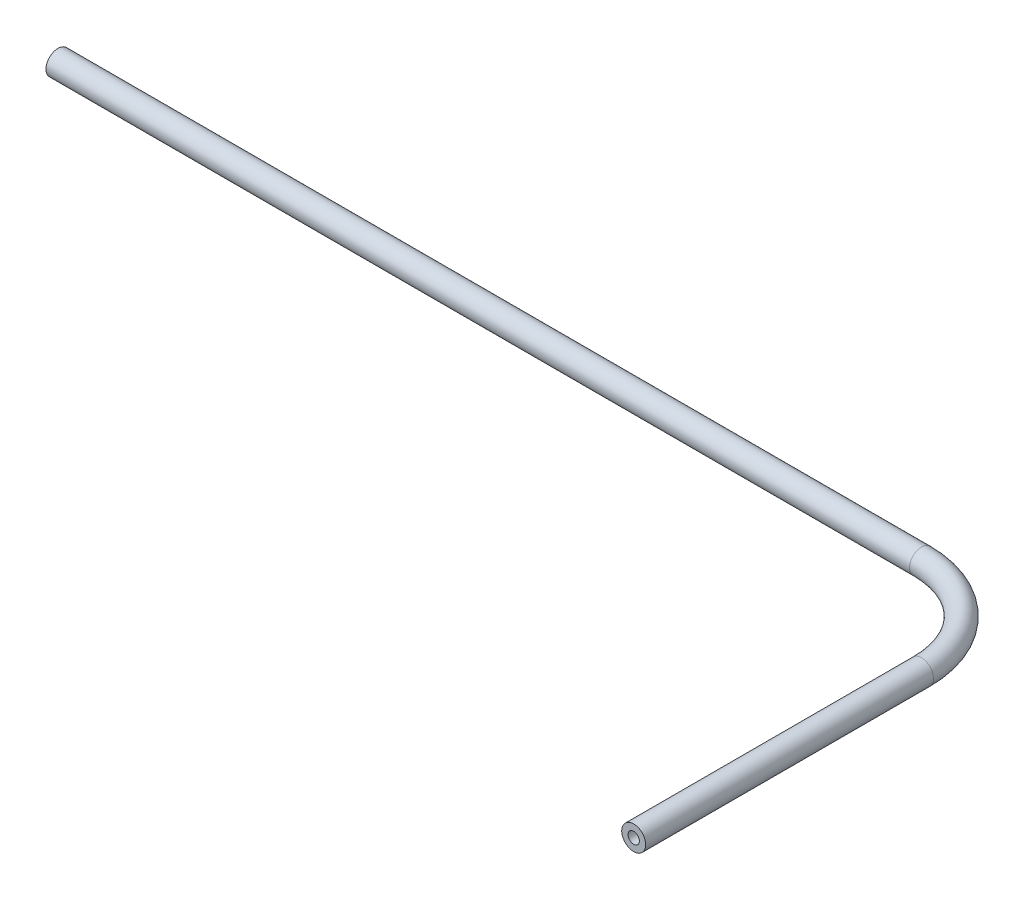
from build123d import *

# Parameters (mm, degrees)
SKETCH2_R   = 3.175
SKETCH2_R_2 = 1.5


with BuildPart() as part:
    # Sweep1: sweep along a path in Sketch1
    with BuildLine(Plane(origin=(0, 0, 0), x_dir=(1, 0, 0), z_dir=(0, 1, 0))) as sweep1_path:
        Line((-254, 0), (-25.4, 0))
        ThreePointArc((-25.4, 0), (-7.439487758, -7.439487758), (0, -25.4))
        Line((0, -25.4), (0, -101.6))
    # Sketch2 → Sweep1 (sweep)
    with BuildSketch(Plane(origin=(-254, 0, 0), x_dir=(0, 0, -1), z_dir=(1, 0, 0))):
        Circle(SKETCH2_R)
        Circle(SKETCH2_R_2, mode=Mode.SUBTRACT)
    sweep(path=sweep1_path.line)


solid = part.part
